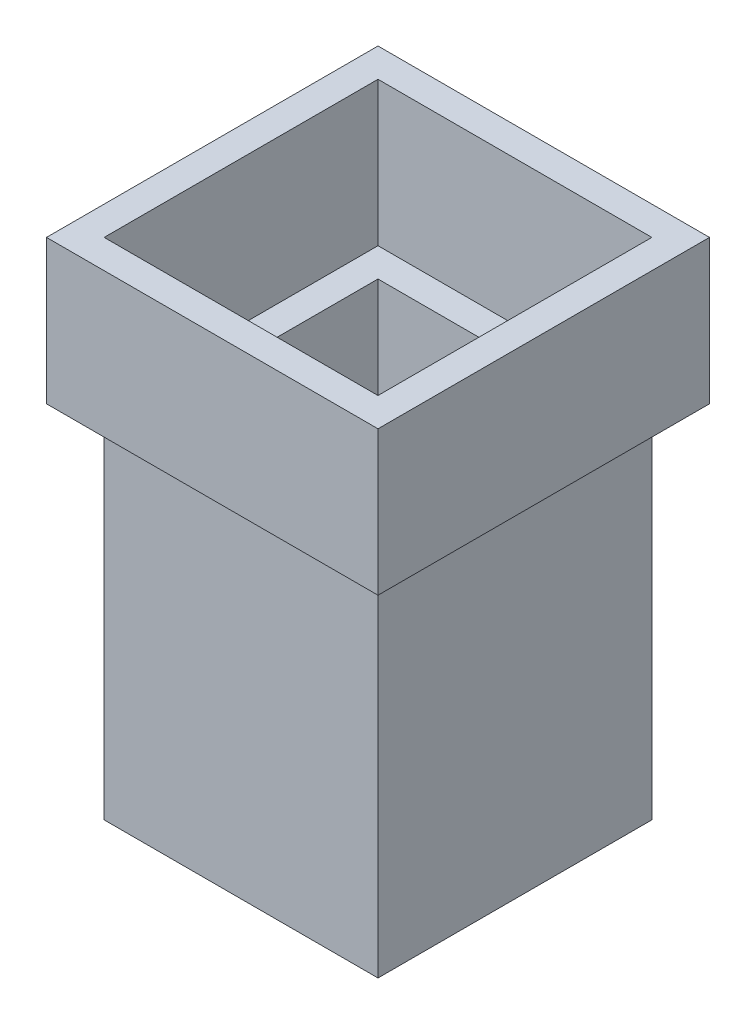
from build123d import *

# Parameters (mm, degrees)
CROQUIS1_W              = 19
CROQUIS1_H              = 19
CROQUIS1_W_2            = 15
CROQUIS1_H_2            = 15
SALIENTE_EXTRUIR1_DEPTH = 25
CROQUIS2_W              = 23
CROQUIS2_H              = 23
CROQUIS2_W_2            = 19
CROQUIS2_H_2            = 19
SALIENTE_EXTRUIR2_DEPTH = 10


with BuildPart() as part:
    # Croquis1 → Saliente-Extruir1 (new body)
    with BuildSketch(Plane(origin=(0, 0, 0), x_dir=(1, 0, 0), z_dir=(0, 1, 0))):
        Rectangle(CROQUIS1_W, CROQUIS1_H)
        Rectangle(CROQUIS1_W_2, CROQUIS1_H_2, mode=Mode.SUBTRACT)
    extrude(amount=SALIENTE_EXTRUIR1_DEPTH)


with BuildPart() as body_2:
    # Croquis2 → Saliente-Extruir2 (new body)
    with BuildSketch(Plane(origin=(0, 25, 0), x_dir=(1, 0, 0), z_dir=(0, 1, 0))):
        Rectangle(CROQUIS2_W, CROQUIS2_H)
        Rectangle(CROQUIS2_W_2, CROQUIS2_H_2, mode=Mode.SUBTRACT)
    extrude(amount=SALIENTE_EXTRUIR2_DEPTH)


solid = Compound([part.part, body_2.part])
